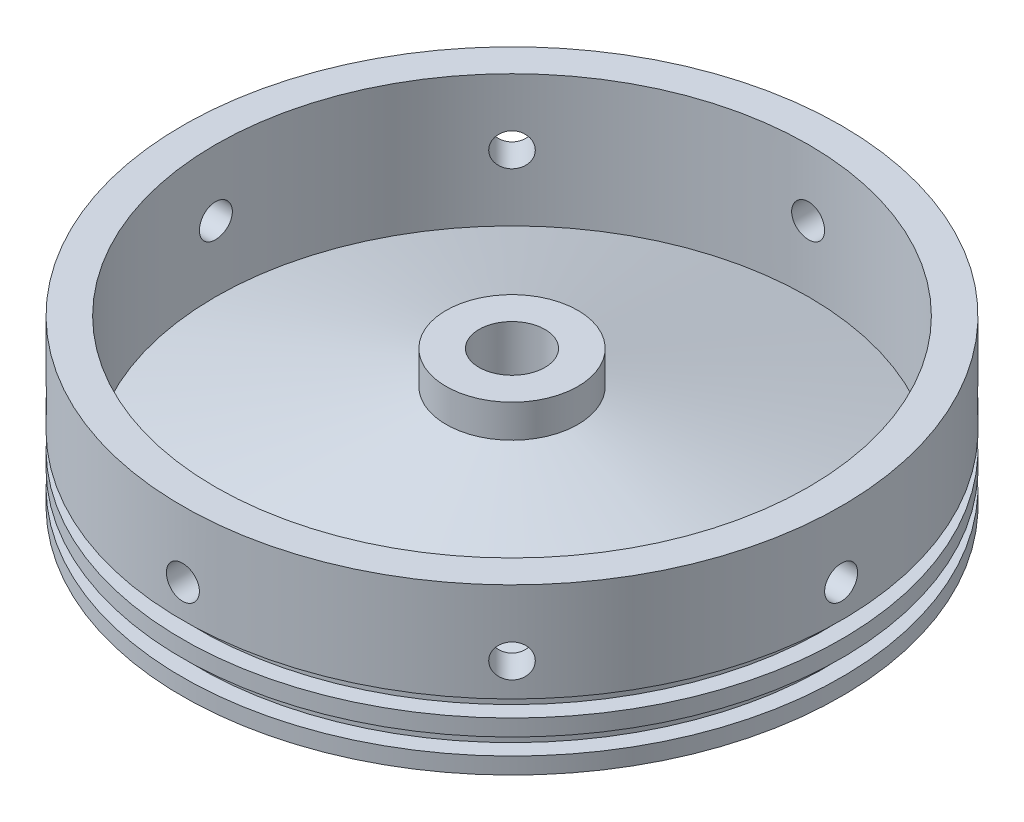
from build123d import *

# Parameters (mm, degrees)
CUT_EXTRUDE2_REACH      = 152.804
CUT_EXTRUDE2_END_RADIUS = 57.15
SKETCH3_R               = 3.175
CIRPATTERN2_COUNT       = 8


with BuildPart() as part:
    # Sketch1 → Revolve2 (revolve)
    with BuildSketch(Plane.XY, mode=Mode.PRIVATE) as revolve2_sk:
        with BuildLine():
            Line((6.35, 45.363399312), (6.35, 32.663399312))
            ThreePointArc((6.35, 32.663399312), (27.556037661, 22.529619114), (50.8, 19.05))
            Line((50.8, 19.05), (63.5, 19.05))
            Line((63.5, 19.05), (63.5, 22.225))
            Line((63.5, 22.225), (60.325, 22.225))
            Line((60.325, 22.225), (60.325, 25.4))
            Line((60.325, 25.4), (63.5, 25.4))
            Line((63.5, 25.4), (63.5, 28.575))
            Line((63.5, 28.575), (60.325, 28.575))
            Line((60.325, 28.575), (60.325, 31.75))
            Line((60.325, 31.75), (63.5, 31.75))
            Line((63.5, 31.75), (63.5, 50.8))
            Line((63.5, 50.8), (57.15, 50.8))
            Line((57.15, 50.8), (57.15, 25.4))
            Line((57.15, 25.4), (12.7, 39.013399312))
            Line((12.7, 39.013399312), (12.7, 45.363399312))
            Line((12.7, 45.363399312), (6.35, 45.363399312))
        make_face()
    revolve(revolve2_sk.sketch.rotate(Axis((0, 0, 0), (0, 1, 0)), 90), axis=Axis((0, 0, 0), (0, 1, 0)))

    # Cut-Extrude2: up to this cylinder (the profile starts outside it)
    cut_extrude2_end = Plane(origin=(0, 38.1, 0), z_dir=(0, -1, 0)) * Cylinder(CUT_EXTRUDE2_END_RADIUS, 420.908, mode=Mode.PRIVATE)
    # Sketch3 → Cut-Extrude2 (cut, up to the surface)
    with BuildSketch(Plane.XY.offset(63.5), mode=Mode.PRIVATE) as cut_extrude2_sk1:
        with Locations((0, 38.1)):
            Circle(SKETCH3_R)
    cut_extrude2_tool1 = extrude(cut_extrude2_sk1.sketch, amount=-CUT_EXTRUDE2_REACH, mode=Mode.PRIVATE) - cut_extrude2_end
    cut_extrude2 = cut_extrude2_tool1.solids().sort_by_distance((0, 38.1, 63.5))[0]
    add(cut_extrude2, mode=Mode.SUBTRACT)

    # CirPattern2: Cut-Extrude2 ×8 about axis
    cirpattern2_axis = Axis((0, 0, 0), (0, -1, 0))
    for i in range(1, CIRPATTERN2_COUNT):
        add(cut_extrude2.rotate(cirpattern2_axis, i * 360 / CIRPATTERN2_COUNT), mode=Mode.SUBTRACT)


solid = part.part
